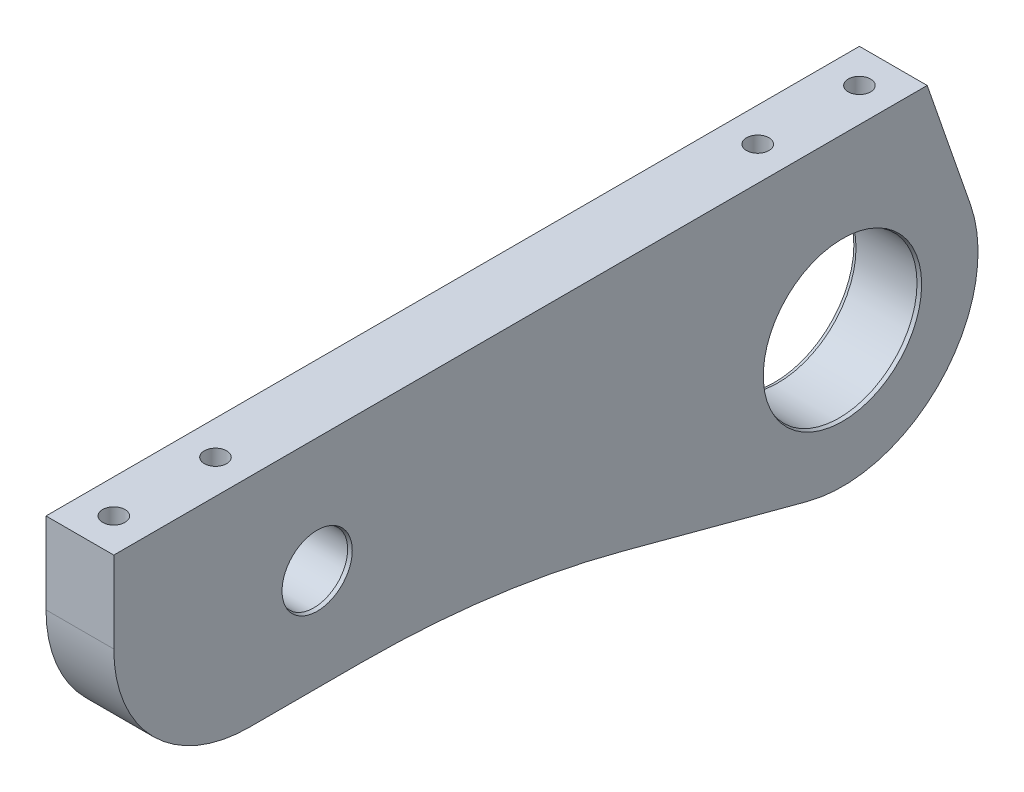
from build123d import *
from OCP.BRepFilletAPI import BRepFilletAPI_MakeChamfer

# Parameters (mm, degrees)
BOSS_EXTRUDE1_DEPTH   = 5
SKETCH4_R             = 11.5
CUT_EXTRUDE1_DEPTH    = 10
M4_TAPPED_HOLE1_D     = 3.3
M4_TAPPED_HOLE1_DEPTH = 11.5
M4_TAPPED_HOLE1_TIP   = 0.991420021
SKETCH5_R             = 5
CUT_EXTRUDE2_DEPTH    = 10
FILLET1_R             = 150
FILLET2_R             = 20
CHAMFER1_SIZE         = 0.5
CHAMFER1_SIZE2        = 0.181985117


with BuildPart() as part:
    # Sketch1 → Boss-Extrude1 (new, symmetric)
    with BuildSketch(Plane(origin=(0, 0, 0), x_dir=(0, 0, -1), z_dir=(1, 0, 0))):
        with BuildLine():
            Line((-60, 0), (60, 0))
            Line((60, 0), (66.396399481, -18.448199741))
            ThreePointArc((66.396399481, -18.448199741), (62.147804381, -38.6177027), (42.341065464, -44.323182824))
            Line((42.341065464, -44.323182824), (-3.816355809, -32))
            Line((-3.816355809, -32), (-60, -32))
            Line((-60, -32), (-60, 0))
        make_face()
    extrude(amount=BOSS_EXTRUDE1_DEPTH, both=True)

    # Sketch4 → Cut-Extrude1 (cut)
    with BuildSketch(Plane(origin=(5, 0, 0), x_dir=(0, 0, -1), z_dir=(1, 0, 0))):
        with Locations((47.5, -25)):
            Circle(SKETCH4_R)
    extrude(amount=-CUT_EXTRUDE1_DEPTH, mode=Mode.SUBTRACT)

    # M4 Tapped Hole1
    with Locations(Plane(origin=(0, 0, 0), x_dir=(1, 0, 0), z_dir=(0, 1, 0))):
        with Locations((0, -55), (0, -40), (0, 40), (0, 55)):
            Hole(M4_TAPPED_HOLE1_D / 2, depth=M4_TAPPED_HOLE1_DEPTH)
            with Locations((0, 0, -(M4_TAPPED_HOLE1_DEPTH + M4_TAPPED_HOLE1_TIP / 2))):  # 118° drill point
                Cone(0, M4_TAPPED_HOLE1_D / 2, M4_TAPPED_HOLE1_TIP, mode=Mode.SUBTRACT)

    # Sketch5 → Cut-Extrude2 (cut)
    with BuildSketch(Plane(origin=(5, 0, 0), x_dir=(0, 0, -1), z_dir=(1, 0, 0))):
        with Locations((-30, -17)):
            Circle(SKETCH5_R)
    extrude(amount=-CUT_EXTRUDE2_DEPTH, mode=Mode.SUBTRACT)

    # Fillet1
    fillet1_edges = [part.edges().sort_by_distance(p)[0] for p in [
        (0, -32, 3.816355809),
    ]]
    fillet(fillet1_edges, radius=FILLET1_R)

    # Fillet2
    fillet2_edges = [part.edges().sort_by_distance(p)[0] for p in [
        (0, -32, 60),
    ]]
    fillet(fillet2_edges, radius=FILLET2_R)

    # Chamfer1: one chamfer whose edges measure the first distance from different faces: ONE call of the kernel's chamfer builder (chamfer() names one face for all edges)
    chamfer1_edges_1 = [part.edges().sort_by_distance(p)[0] for p in [
        (-5, -25, -36),
        (5, -25, -36),
    ]]
    chamfer1_side_1 = [part.faces().sort_by_distance(p)[0] for p in [
        (0, -25, -36),
    ]]
    chamfer1_edges_2 = [part.edges().sort_by_distance(p)[0] for p in [
        (-5, -17, 35),
        (5, -17, 35),
    ]]
    chamfer1_side_2 = [part.faces().sort_by_distance(p)[0] for p in [
        (0, -17, 35),
    ]]
    chamfer1 = BRepFilletAPI_MakeChamfer(part.part.solid().wrapped)
    for e in chamfer1_edges_1:
        chamfer1.Add(CHAMFER1_SIZE, CHAMFER1_SIZE2, e.wrapped, chamfer1_side_1[0].wrapped)  # the first distance lies on this face
    for e in chamfer1_edges_2:
        chamfer1.Add(CHAMFER1_SIZE, CHAMFER1_SIZE2, e.wrapped, chamfer1_side_2[0].wrapped)  # the first distance lies on this face
    add(Compound.cast(chamfer1.Shape()), mode=Mode.REPLACE)


solid = part.part
